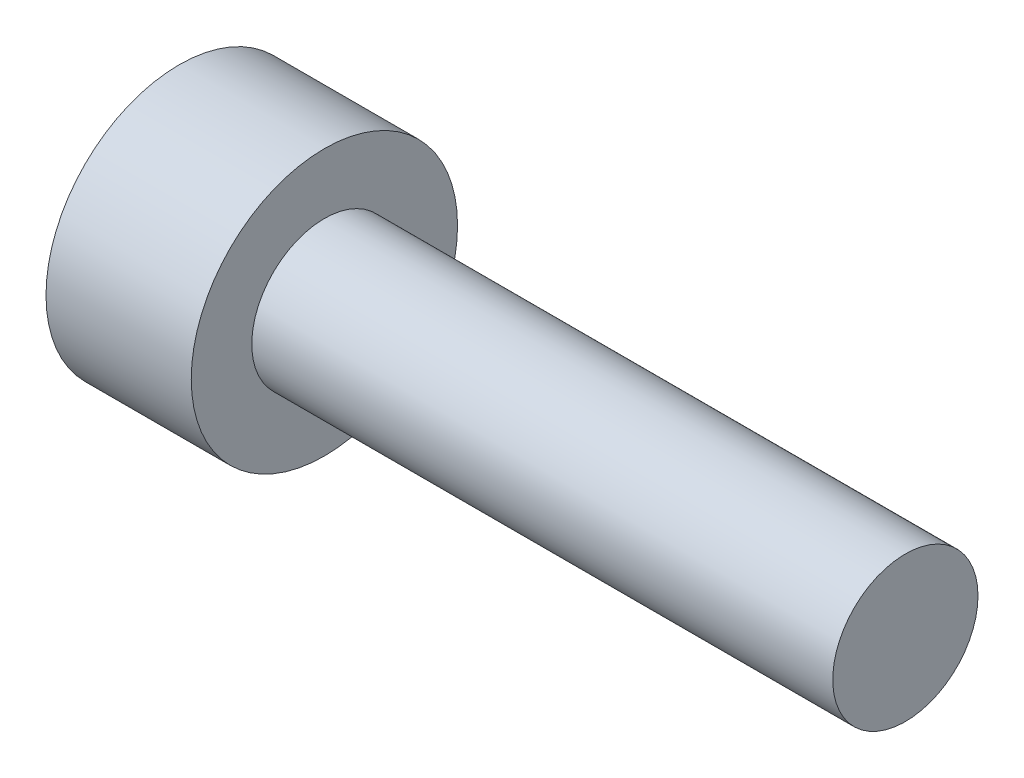
from build123d import *

# Parameters (mm, degrees)
M3_SHANK_SKETCH_R      = 1.5
M3_SHANK_DEPTH         = 12
M3_SCREW_HEAD_SKETCH_R = 2.75
M3_SCREW_HEAD_DEPTH    = 3


with BuildPart() as part:
    # M3 shank sketch → M3 shank (new body)
    with BuildSketch(Plane(origin=(13, 0, 0), x_dir=(0, 0, -1), z_dir=(1, 0, 0))):
        with Locations((11.5, -38)):
            Circle(M3_SHANK_SKETCH_R)
    extrude(amount=M3_SHANK_DEPTH)

    # M3 screw head sketch → M3 screw head (add)
    with BuildSketch(Plane(origin=(10, 0, 0), x_dir=(0, 0, -1), z_dir=(1, 0, 0))):
        with Locations((11.5, -38)):
            Circle(M3_SCREW_HEAD_SKETCH_R)
    extrude(amount=M3_SCREW_HEAD_DEPTH)


solid = part.part
